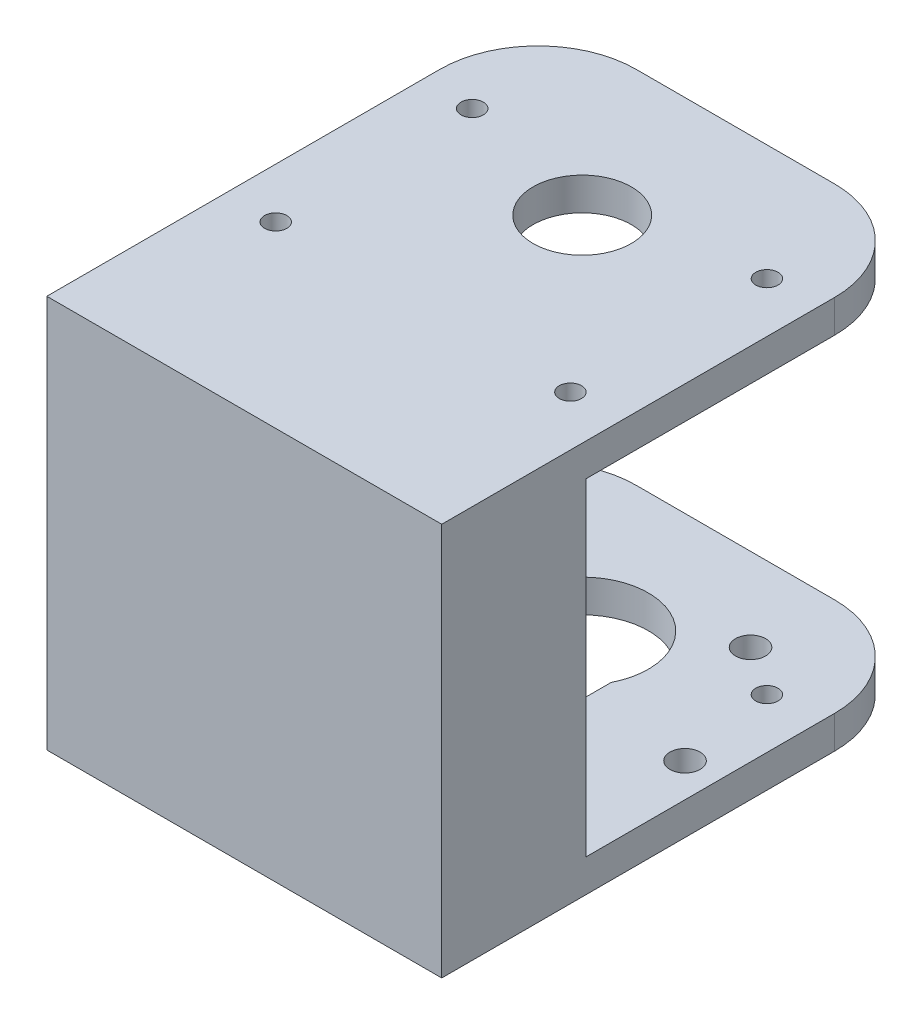
from build123d import *

# Parameters (mm, degrees)
SKETCH2_R           = 2.3
SKETCH2_R_2         = 1.7
BOSS_EXTRUDE1_DEPTH = 5
BOSS_EXTRUDE2_DEPTH = 5
SKETCH4_W           = 60.3
SKETCH4_H           = 15
BOSS_EXTRUDE3_DEPTH = 50
SKETCH5_R           = 1.7
SKETCH5_R_2         = 7.5
BOSS_EXTRUDE4_DEPTH = 5
SKETCH7_W           = 60.3
SKETCH7_H           = 50
BOSS_EXTRUDE6_DEPTH = 7


with BuildPart() as part:
    # Sketch2 → Boss-Extrude1 (new body)
    with BuildSketch(Plane(origin=(0, 0, 0), x_dir=(1, 0, 0), z_dir=(0, 1, 0))):
        with BuildLine():
            Line((15.15, -32.7), (-15.15, -32.7))
            ThreePointArc((-15.15, -32.7), (-25.756601718, -28.306601718), (-30.15, -17.7))
            Line((-30.15, -17.7), (-30.15, 17.7))
            ThreePointArc((-30.15, 17.7), (-25.756601718, 28.306601718), (-15.15, 32.7))
            Line((-15.15, 32.7), (15.15, 32.7))
            ThreePointArc((15.15, 32.7), (25.756601718, 28.306601718), (30.15, 17.7))
            Line((30.15, 17.7), (30.15, -17.7))
            ThreePointArc((30.15, -17.7), (25.756601718, -28.306601718), (15.15, -32.7))
        make_face()
        with Locations(Location((-15, 20, 0), (0, 0, 270))):
            Circle(SKETCH2_R, mode=Mode.SUBTRACT)
        with Locations(Location((-25, 0, 0), (0, 0, 270))):
            Circle(SKETCH2_R, mode=Mode.SUBTRACT)
        with Locations(Location((-15, -20, 0), (0, 0, 270))):
            Circle(SKETCH2_R, mode=Mode.SUBTRACT)
        with Locations(Location((-22.5, -15, 0), (0, 0, 270))):
            Circle(SKETCH2_R_2, mode=Mode.SUBTRACT)
        with Locations(Location((-22.5, 15, 0), (0, 0, 270))):
            Circle(SKETCH2_R_2, mode=Mode.SUBTRACT)
        with Locations(Location((15, 20, 0), (0, 0, 90))):
            Circle(SKETCH2_R, mode=Mode.SUBTRACT)
        with Locations(Location((22.5, 15, 0), (0, 0, 90))):
            Circle(SKETCH2_R_2, mode=Mode.SUBTRACT)
        with Locations(Location((25, 0, 0), (0, 0, 90))):
            Circle(SKETCH2_R, mode=Mode.SUBTRACT)
        with Locations(Location((22.5, -15, 0), (0, 0, 90))):
            Circle(SKETCH2_R_2, mode=Mode.SUBTRACT)
        with Locations(Location((15, -20, 0), (0, 0, 90))):
            Circle(SKETCH2_R, mode=Mode.SUBTRACT)
        with BuildLine():
            Line((-9, 4.716333345), (-9, -16.9))
            Line((-9, -16.9), (9, -16.9))
            Line((9, -16.9), (9, 4.716333345))
            ThreePointArc((9, 4.716333345), (0, 19.4), (-9, 4.716333345))
        make_face(mode=Mode.SUBTRACT)
    extrude(amount=BOSS_EXTRUDE1_DEPTH)

    # Sketch3 → Boss-Extrude2 (add)
    with BuildSketch(Plane.XZ):
        Polygon((-30.15, 17.7), (-30.15, 42.3), (30.15, 42.3), (30.15, 17.7), (15.15, 32.7), (-15.15, 32.7), align=None)
    extrude(amount=-BOSS_EXTRUDE2_DEPTH)

    # Sketch4 → Boss-Extrude3 (add)
    with BuildSketch(Plane(origin=(0, 5, 0), x_dir=(1, 0, 0), z_dir=(0, 1, 0))):
        with Locations((0, -34.8)):
            Rectangle(SKETCH4_W, SKETCH4_H)
    extrude(amount=BOSS_EXTRUDE3_DEPTH)

    # Sketch5 → Boss-Extrude4 (add)
    with BuildSketch(Plane(origin=(0, 55, 0), x_dir=(1, 0, 0), z_dir=(0, 1, 0))):
        with BuildLine():
            Line((-30.15, -42.3), (30.15, -42.3))
            Line((30.15, -42.3), (30.15, 17.7))
            ThreePointArc((30.15, 17.7), (25.756601718, 28.306601718), (15.15, 32.7))
            Line((15.15, 32.7), (-15.15, 32.7))
            ThreePointArc((-15.15, 32.7), (-25.756601718, 28.306601718), (-30.15, 17.7))
            Line((-30.15, 17.7), (-30.15, -42.3))
        make_face()
        with Locations(Location((-22.5, 15, 0), (0, 0, 270))):
            Circle(SKETCH5_R, mode=Mode.SUBTRACT)
        with Locations(Location((-22.5, -15, 0), (0, 0, 270))):
            Circle(SKETCH5_R, mode=Mode.SUBTRACT)
        with Locations(Location((22.5, 15, 0), (0, 0, 90))):
            Circle(SKETCH5_R, mode=Mode.SUBTRACT)
        with Locations(Location((22.5, -15, 0), (0, 0, 90))):
            Circle(SKETCH5_R, mode=Mode.SUBTRACT)
        with Locations(Location((0, 9.3, 0), (0, 0, 270))):
            Circle(SKETCH5_R_2, mode=Mode.SUBTRACT)
    extrude(amount=BOSS_EXTRUDE4_DEPTH)

    # Sketch7 → Boss-Extrude6 (add)
    with BuildSketch(Plane(origin=(0, 0, 27.3), x_dir=(-1, 0, 0), z_dir=(0, 0, -1))):
        with Locations((0, 30)):
            Rectangle(SKETCH7_W, SKETCH7_H)
    extrude(amount=BOSS_EXTRUDE6_DEPTH)


solid = part.part
